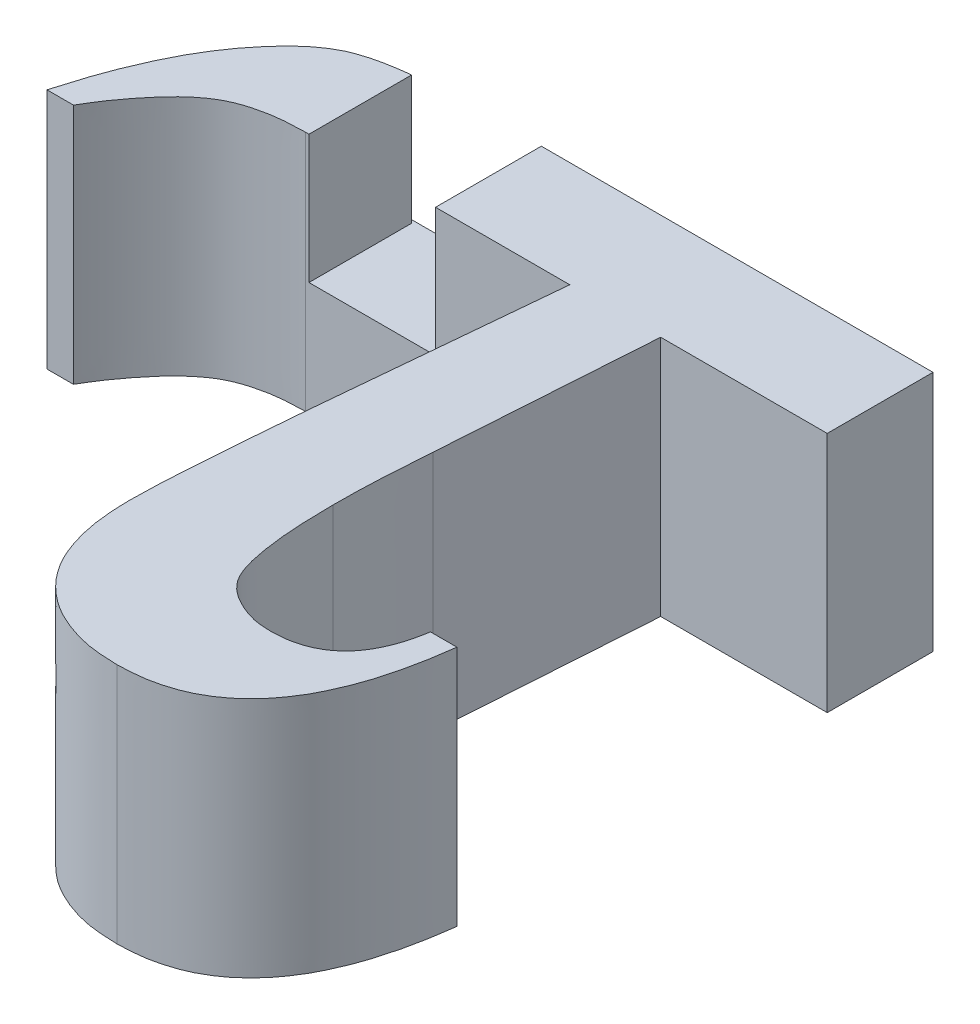
from build123d import *

# Parameters (mm, degrees)
BOSS_EXTRUDE1_DEPTH     = 12.7
CUT_EXTRUDE2_DEPTH      = 52.709076543
CUT_EXTRUDE2_DEPTH_BACK = 12.7
SKETCH4_W               = 5.555555556
SKETCH4_H               = 5.954243766
BOSS_EXTRUDE2_DEPTH     = 7


with BuildPart() as part:
    # Sketch2 → Boss-Extrude1 (new body)
    with BuildSketch(Plane(origin=(0, 0, 0), x_dir=(1, 0, 0), z_dir=(0, 1, 0))):
        with BuildLine():
            Line((36.805555556, 34.027777778), (36.805555556, 28.472222222))
            Line((36.805555556, 28.472222222), (28.059895833, 28.472222222))
            Line((28.059895833, 28.472222222), (27.311197917, 17.274305556))
            add(Edge.make_bspline(
                [(27.311197917, 17.274305556), (27.277795656, 16.804166639), (27.213581874, 15.900353642), (27.134284285, 14.591279231), (27.088344823, 13.379251723), (27.084956214, 12.601307574), (27.083333333, 12.228732639)],
                knots=[0, 0, 0, 0, 1.119532368, 2.152231754, 3.115062263, 4, 4, 4, 4], degree=3))
            add(Edge.make_bspline(
                [(27.083333333, 12.228732639), (27.088274581, 11.823604319), (27.097676522, 11.052747972), (27.1463749, 9.958919939), (27.245170271, 8.988755862), (27.371002693, 8.143926135), (27.529152233, 7.419430528), (27.728457334, 6.818301639), (27.97650636, 6.339464464), (28.352227221, 5.878445418), (28.902546694, 5.47047021), (29.612022333, 5.12581616), (30.381545964, 4.888099058), (30.919027092, 4.870283408), (31.195746528, 4.861111111)],
                knots=[0, 0, 0, 0, 1.508120221, 2.869569927, 4.073906796, 5.136392291, 6.047624064, 6.831039609, 7.487569696, 8.042672177, 9.031004047, 10.006413578, 10.97361213, 12, 12, 12, 12], degree=3))
            add(Edge.make_bspline(
                [(31.195746528, 4.861111111), (31.47916585, 4.872136088), (32.020929674, 4.893210634), (32.788220791, 5.094099051), (33.466107529, 5.423211567), (34.05259416, 5.891325855), (34.548953998, 6.488400226), (34.936220725, 7.22238631), (35.244986398, 8.076473761), (35.357486114, 8.699850181), (35.416666667, 9.027777778)],
                knots=[0, 0, 0, 0, 1.033647866, 1.975846305, 2.874029418, 3.767535477, 4.696297243, 5.689637366, 6.784632136, 8, 8, 8, 8], degree=3))
            Line((35.416666667, 9.027777778), (36.805555556, 9.027777778))
            add(Edge.make_bspline(
                [(36.805555556, 9.027777778), (36.751313392, 8.636593642), (36.645430641, 7.872987448), (36.430993277, 6.771079076), (36.1666915, 5.743505172), (35.873825885, 4.788096172), (35.503638642, 3.918308722), (35.126438428, 3.108890157), (34.67022236, 2.39005292), (34.190460036, 1.734735752), (33.64770155, 1.167708505), (33.078282467, 0.661363985), (32.447526517, 0.251271838), (31.785619175, -0.107880779), (31.064059185, -0.356214557), (30.308826122, -0.563500536), (29.502063403, -0.664205141), (28.949843487, -0.684214933), (28.667534722, -0.694444444)],
                knots=[0, 0, 0, 0, 1.346490984, 2.628401203, 3.824883511, 4.963792231, 6.031069444, 7.045970716, 8.004214277, 8.929182016, 9.810359102, 10.675861826, 11.520733207, 12.370272421, 13.236390006, 14.115839292, 15.03676947, 16, 16, 16, 16], degree=3))
            add(Edge.make_bspline(
                [(28.667534722, -0.694444444), (28.154682861, -0.675816782), (27.164131243, -0.639838242), (25.766335044, -0.242024901), (24.512145619, 0.369174112), (23.621609051, 1.101026149), (23.010255911, 1.797210882), (22.609852371, 2.383817061), (22.268478936, 3.030858971), (22.003101082, 3.740487332), (21.782965902, 4.501315843), (21.632459475, 5.322642072), (21.547875637, 6.204798769), (21.53462541, 6.814049436), (21.527777778, 7.12890625)],
                knots=[0, 0, 0, 0, 1.53176672, 2.958542455, 4.314758716, 5.68491526, 6.375705814, 7.084681483, 7.806528549, 8.560798466, 9.349284224, 10.175616502, 11.057170379, 12, 12, 12, 12], degree=3))
            add(Edge.make_bspline(
                [(21.527777778, 7.12890625), (21.530511411, 7.37125412), (21.536674087, 7.917600965), (21.569321673, 8.825873224), (21.639359606, 9.910585643), (21.725996598, 11.172904628), (21.834635018, 12.612456183), (21.96658957, 14.232690848), (22.114735136, 16.030968586), (22.235168036, 17.288909187), (22.298177083, 17.947048611)],
                knots=[0, 0, 0, 0, 0.536190643, 1.208783333, 2.010417809, 2.94084931, 4.00811323, 5.204264869, 6.537304937, 8, 8, 8, 8], degree=3))
            Line((22.298177083, 17.947048611), (23.285590278, 28.472222222))
            Line((23.285590278, 28.472222222), (15.277777778, 28.472222222))
            add(Edge.make_bspline(
                [(15.277777778, 28.472222222), (15.214460278, 27.401507925), (15.092072877, 25.331907254), (14.886109564, 22.340596723), (14.670777515, 19.573381685), (14.442846588, 17.030553937), (14.208342944, 14.71137929), (13.954506302, 12.617981517), (13.715610292, 10.74508508), (13.436521107, 9.086740026), (13.164846669, 7.602952782), (12.886850841, 6.270387957), (12.590238795, 5.07441313), (12.303899426, 4.011159992), (12.003972777, 3.085637953), (11.686744628, 2.301603715), (11.378814424, 1.642404725), (10.958043065, 0.964152103), (10.358101863, 0.292051075), (9.505081424, -0.285187523), (8.526340218, -0.641645855), (7.833640049, -0.676470824), (7.476128472, -0.694444444)],
                knots=[0, 0, 0, 0, 2.01044623, 3.886023449, 5.620111306, 7.212895615, 8.671360263, 9.989066837, 11.16552434, 12.209857215, 13.140654073, 13.99296191, 14.760845937, 15.449993852, 16.056713946, 16.582946555, 17.034739681, 17.418487115, 18.076100987, 18.706013306, 19.33215662, 20, 20, 20, 20], degree=3))
            add(Edge.make_bspline(
                [(7.476128472, -0.694444444), (7.207412809, -0.681627697), (6.681489385, -0.656543087), (5.927311086, -0.469815134), (5.234803565, -0.159026243), (4.623769653, 0.271526397), (4.10585267, 0.797998542), (3.737602188, 1.427988796), (3.515453468, 2.133829731), (3.486861324, 2.631486012), (3.472222222, 2.886284722)],
                knots=[0, 0, 0, 0, 1.073515936, 2.101057932, 3.084730514, 4.091615775, 5.073373561, 6.013242394, 6.982785322, 8, 8, 8, 8], degree=3))
            add(Edge.make_bspline(
                [(3.472222222, 2.886284722), (3.49977796, 3.167601475), (3.56174898, 3.800264126), (3.975195909, 4.785596558), (4.58793497, 5.912424554), (5.130000946, 6.671771181), (5.425347222, 7.085503472)],
                knots=[0, 0, 0, 0, 0.719350384, 1.617771125, 2.702035439, 4, 4, 4, 4], degree=3))
            add(Edge.make_bspline(
                [(5.425347222, 7.085503472), (5.880890291, 7.733268934), (6.778468477, 9.009592048), (7.924062056, 11.019134082), (8.912809694, 13.051591024), (9.583491505, 14.814505434), (10.052627408, 16.316401679), (10.355193153, 17.603017915), (10.666713374, 19.033013262), (10.926646603, 20.624922957), (11.194761694, 22.366552488), (11.410609585, 24.268277428), (11.637107009, 26.317618199), (11.748122743, 27.737606389), (11.805555556, 28.472222222)],
                knots=[0, 0, 0, 0, 1.256859471, 2.476450027, 3.668368903, 4.842737386, 5.467680022, 6.165560467, 6.940549266, 7.791280764, 8.726175375, 9.738470097, 10.830021485, 12, 12, 12, 12], degree=3))
            Line((11.805555556, 28.472222222), (9.407552083, 28.472222222))
            add(Edge.make_bspline(
                [(9.407552083, 28.472222222), (8.954085196, 28.460620671), (8.094301289, 28.438623856), (6.890732805, 28.196638527), (5.842130851, 27.81794011), (4.969568852, 27.229936528), (4.197964836, 26.514921386), (3.47646424, 25.663099106), (2.739413588, 24.704465568), (2.307624449, 23.984891132), (2.083333333, 23.611111111)],
                knots=[0, 0, 0, 0, 1.164670171, 2.208242094, 3.144640406, 4.011598175, 4.893941805, 5.843464191, 6.879796223, 8, 8, 8, 8], degree=3))
            Line((2.083333333, 23.611111111), (0.694444444, 23.611111111))
            add(Edge.make_bspline(
                [(0.694444444, 23.611111111), (0.877085401, 24.232597394), (1.229291, 25.431074191), (1.886266978, 27.119888333), (2.60411942, 28.642568556), (3.40397479, 29.980706486), (4.259111756, 31.115981615), (5.118517845, 32.058955597), (5.996672541, 32.785861584), (6.772590288, 33.224850634), (7.449074281, 33.455523285), (8.027104125, 33.619326955), (8.696031334, 33.743397524), (9.444623844, 33.855790163), (10.28602055, 33.921881494), (11.211287579, 33.993942488), (12.22496831, 34.020966417), (12.926797761, 34.025446099), (13.292100694, 34.027777778)],
                knots=[0, 0, 0, 0, 1.702237036, 3.282601159, 4.758360036, 6.123233304, 7.372634412, 8.489452943, 9.469553166, 10.358928799, 10.813046741, 11.345939706, 11.937066667, 12.599998432, 13.335161994, 14.154869419, 15.039607681, 16, 16, 16, 16], degree=3))
            Line((13.292100694, 34.027777778), (36.805555556, 34.027777778))
        make_face()
    extrude(amount=BOSS_EXTRUDE1_DEPTH)

    # Sketch3 → Cut-Extrude2 (cut, two sides: drawn at the far end of the back side and taken through both)
    with BuildSketch(Plane(origin=(0, 12.7, 0), x_dir=(1, 0, 0), z_dir=(0, 1, 0)).offset(-CUT_EXTRUDE2_DEPTH_BACK)):
        with BuildLine():
            Line((15.277777778, 28.472222222), (11.805555556, 28.472222222))
            add(Edge.make_bspline(
                [(11.805555556, 28.472222222), (11.748122743, 27.737606389), (11.637107009, 26.317618199), (11.410609585, 24.268277428), (11.194761694, 22.366552488), (10.926646603, 20.624922957), (10.666713374, 19.033013262), (10.355193153, 17.603017915), (10.052627408, 16.316401679), (9.583491505, 14.814505434), (8.912809694, 13.051591024), (7.924062056, 11.019134082), (6.778468477, 9.009592048), (5.880890291, 7.733268934), (5.425347222, 7.085503472)],
                knots=[0, 0, 0, 0, 0.09749821, 0.188460825, 0.272818719, 0.350726603, 0.421620894, 0.486203294, 0.544359998, 0.596438551, 0.694302591, 0.793629164, 0.895261711, 1, 1, 1, 1], degree=3))
            add(Edge.make_bspline(
                [(5.425347222, 7.085503472), (5.130000946, 6.671771181), (4.58793497, 5.912424554), (3.975195909, 4.785596558), (3.56174898, 3.800264126), (3.49977796, 3.167601475), (3.472222222, 2.886284722)],
                knots=[0, 0, 0, 0, 0.32449114, 0.595557219, 0.820162404, 1, 1, 1, 1], degree=3))
            add(Edge.make_bspline(
                [(3.472222222, 2.886284722), (3.486861324, 2.631486012), (3.515453468, 2.133829731), (3.737602188, 1.427988796), (4.10585267, 0.797998542), (4.623769653, 0.271526397), (5.234803565, -0.159026243), (5.927311086, -0.469815134), (6.681489385, -0.656543087), (7.207412809, -0.681627697), (7.476128472, -0.694444444)],
                knots=[0, 0, 0, 0, 0.127151835, 0.248344701, 0.365828305, 0.488548028, 0.614408686, 0.737367758, 0.865810508, 1, 1, 1, 1], degree=3))
            add(Edge.make_bspline(
                [(7.476128472, -0.694444444), (7.833640049, -0.676470824), (8.526340218, -0.641645855), (9.505081424, -0.285187523), (10.358101863, 0.292051075), (10.958043065, 0.964152103), (11.378814424, 1.642404725), (11.686744628, 2.301603715), (12.003972777, 3.085637953), (12.303899426, 4.011159992), (12.590238795, 5.07441313), (12.886850841, 6.270387957), (13.164846669, 7.602952782), (13.436521107, 9.086740026), (13.715610292, 10.74508508), (13.954506302, 12.617981517), (14.208342944, 14.71137929), (14.442846588, 17.030553937), (14.670777515, 19.573381685), (14.886109564, 22.340596723), (15.092072877, 25.331907254), (15.214460278, 27.401507925), (15.277777778, 28.472222222)],
                knots=[0, 0, 0, 0, 0.033392169, 0.064699335, 0.096194951, 0.129075644, 0.148263016, 0.170852672, 0.197164303, 0.227500307, 0.261957703, 0.300351905, 0.342967296, 0.389507139, 0.441723783, 0.500546658, 0.566431987, 0.639355219, 0.718994435, 0.805698828, 0.899477689, 1, 1, 1, 1], degree=3))
        make_face()
        with BuildLine():
            Line((9.591392396, 33.862133441), (9.591392396, 28.472222222))
            Line((9.591392396, 28.472222222), (11.805555556, 28.472222222))
            Line((11.805555556, 28.472222222), (15.277777778, 28.472222222))
            Line((15.277777778, 28.472222222), (16.237282416, 28.472222222))
            Line((16.237282416, 28.472222222), (16.237282416, 34.027777778))
            Line((16.237282416, 34.027777778), (13.292100694, 34.027777778))
            add(Edge.make_bspline(
                [(13.292100694, 34.027777778), (12.926797761, 34.025446099), (12.22496831, 34.020966417), (11.211287579, 33.993942488), (10.343864349, 33.926386444), (9.811849706, 33.884631797), (9.591392396, 33.862133441)],
                knots=[0, 0, 0, 0, 0.06002452, 0.115320661, 0.166552375, 0.202967967, 0.202967967, 0.202967967, 0.202967967], degree=3))
        make_face()
    extrude(amount=CUT_EXTRUDE2_DEPTH + CUT_EXTRUDE2_DEPTH_BACK, mode=Mode.SUBTRACT)


with BuildPart() as cut_extrude2_piece_1:
    # of the separate pieces the step leaves, piece 1, a body of its own (cut_extrude2_pieces)
    add(part.part.solids().sort_by_distance((36.805555556, 0, -34.027777778))[0])



with BuildPart() as cut_extrude2_piece_2:
    # of the separate pieces the step leaves, piece 2, a body of its own (cut_extrude2_pieces)
    add(part.part.solids().sort_by_distance((0.694444444, 0, -23.611111111))[0])


with BuildPart() as cut_extrude2_piece_1_1:
    add(cut_extrude2_piece_1.part)

    add(cut_extrude2_piece_2.part)  # Boss-Extrude2 merges Cut-Extrude2 piece 2
    # Sketch4 → Boss-Extrude2 (add)
    with BuildSketch(Plane.ZY.offset(-16.237282416)):
        with Locations((-31.25, 2.977121883)):
            Rectangle(SKETCH4_W, SKETCH4_H)
    extrude(amount=BOSS_EXTRUDE2_DEPTH)


solid = cut_extrude2_piece_1_1.part
